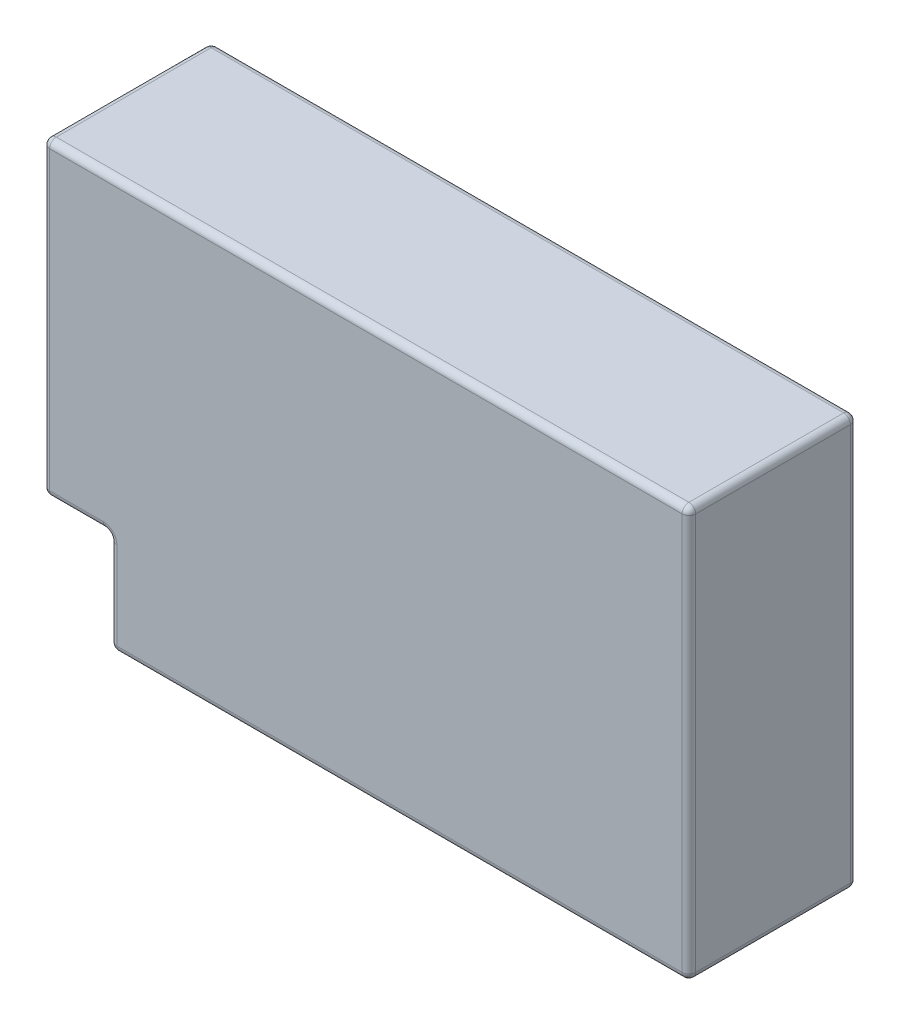
from build123d import *

# Parameters (mm, degrees)
DODANIE_WYCI_GNI_CIE1_DEPTH = 25
ZAOKR_GLENIE3_R             = 1


with BuildPart() as part:
    # Szkic1 → Dodanie-wyciągnięcie1 (new body)
    with BuildSketch(Plane.XY):
        Polygon((-34.478406184, 29.894019729), (-34.478406184, -16.105980271), (-24.478406184, -16.105980271), (-24.478406184, -31.105980271), (61.521593816, -31.105980271), (61.521593816, 29.894019729), align=None)
    extrude(amount=DODANIE_WYCI_GNI_CIE1_DEPTH)

    # Zaokrąglenie3
    zaokr_glenie3_edges = [part.edges().sort_by_distance(p)[0] for p in [
        (-29.478406184, -16.105980271, 25),
        (61.521593816, 29.894019729, 12.5),
        (61.521593816, -31.105980271, 12.5),
        (-24.478406184, -31.105980271, 12.5),
        (-24.478406184, -16.105980271, 12.5),
        (-34.478406184, -16.105980271, 12.5),
        (-34.478406184, 29.894019729, 12.5),
        (-24.478406184, -23.605980271, 25),
        (18.521593816, -31.105980271, 25),
        (61.521593816, -0.605980271, 25),
        (13.521593816, 29.894019729, 25),
        (61.521593816, -0.605980271, 0),
        (18.521593816, -31.105980271, 0),
        (-24.478406184, -23.605980271, 0),
        (-34.478406184, 6.894019729, 25),
        (-29.478406184, -16.105980271, 0),
        (-34.478406184, 6.894019729, 0),
        (13.521593816, 29.894019729, 0),
    ]]
    fillet(zaokr_glenie3_edges, radius=ZAOKR_GLENIE3_R)


solid = part.part
